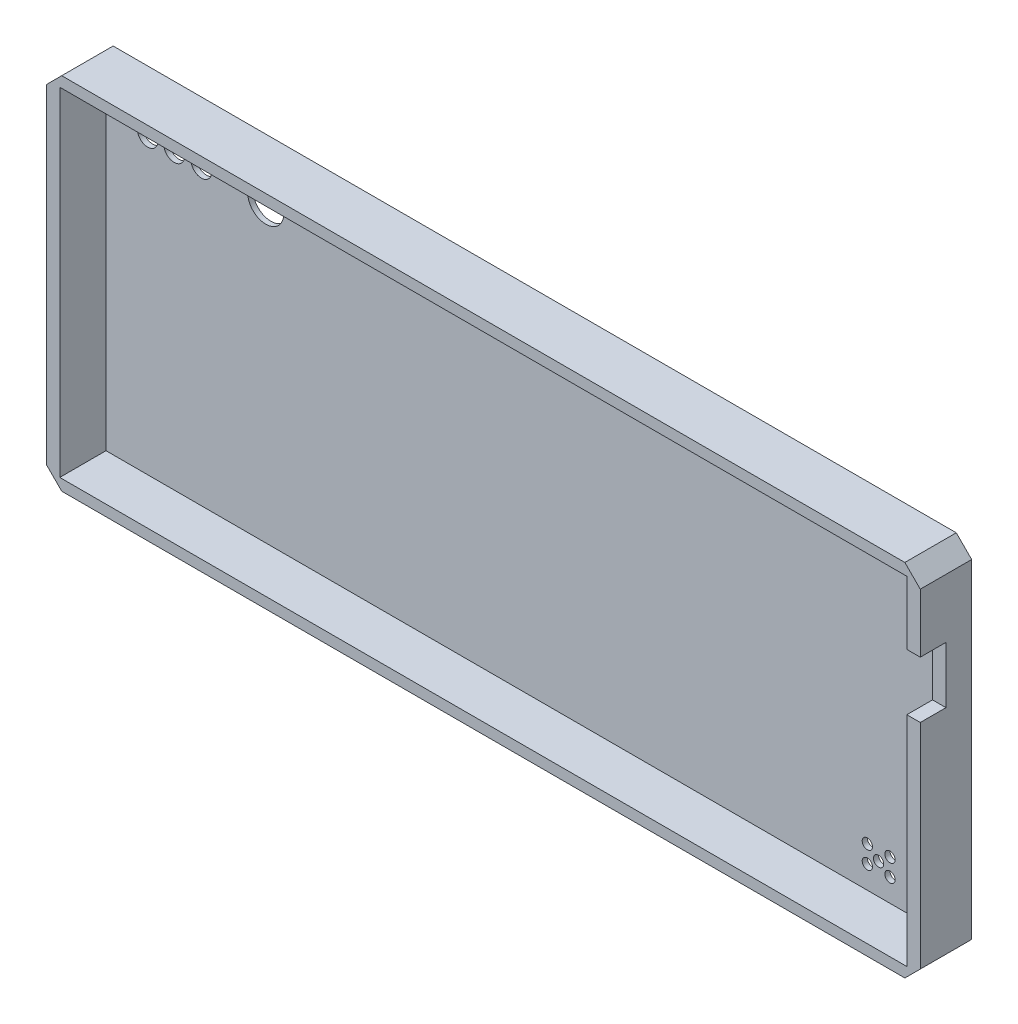
from build123d import *

# Parameters (mm, degrees)
SKETCH1_W           = 170
SKETCH1_H           = 70
BOSS_EXTRUDE1_DEPTH = 10
SKETCH2_W           = 164.770446208
SKETCH2_H           = 65.738312044
CUT_EXTRUDE1_DEPTH  = 9
CHAMFER1_SIZE       = 3
SKETCH3_R           = 1
CUT_EXTRUDE2_DEPTH  = 9
SKETCH4_W           = 5
SKETCH4_H           = 11
CUT_EXTRUDE3_DEPTH  = 9
SKETCH5_R           = 2
SKETCH5_R_2         = 3.5
CUT_EXTRUDE4_DEPTH  = 9
SKETCH7_W           = 0.854807693
SKETCH7_H           = 9.769230769
BOSS_EXTRUDE3_DEPTH = 1


with BuildPart() as part:
    # Sketch1 → Boss-Extrude1 (new body)
    with BuildSketch(Plane.XY):
        with Locations((85, -35)):
            Rectangle(SKETCH1_W, SKETCH1_H)
    extrude(amount=BOSS_EXTRUDE1_DEPTH)

    # Sketch2 → Cut-Extrude1 (cut)
    with BuildSketch(Plane.XY.offset(10)):
        with Locations((85, -35)):
            Rectangle(SKETCH2_W, SKETCH2_H)
    extrude(amount=-CUT_EXTRUDE1_DEPTH, mode=Mode.SUBTRACT)

    # Chamfer1
    chamfer1_edges = [part.edges().sort_by_distance(p)[0] for p in [
        (0, 0, 5),
        (170, 0, 5),
        (170, -70, 5),
        (0, -70, 5),
    ]]
    chamfer(chamfer1_edges, length=CHAMFER1_SIZE)

    # Sketch3 → Cut-Extrude2 (cut)
    with BuildSketch(Plane(origin=(0, 0, 0), x_dir=(-1, 0, 0), z_dir=(0, 0, -1))):
        with Locations((-150.703730792, -63.429213829)):
            Circle(SKETCH3_R)
        with Locations((-155.103392368, -63.429213829)):
            Circle(SKETCH3_R)
        with Locations((-150.703730792, -60.050146517)):
            Circle(SKETCH3_R)
        with Locations((-155.103392368, -60.050146517)):
            Circle(SKETCH3_R)
        with Locations((-152.88343436, -61.881616392)):
            Circle(SKETCH3_R)
    extrude(amount=-CUT_EXTRUDE2_DEPTH, mode=Mode.SUBTRACT)

    # Sketch4 → Cut-Extrude3 (cut)
    with BuildSketch(Plane(origin=(170, 0, 0), x_dir=(0, 0, -1), z_dir=(1, 0, 0))):
        with Locations((-7.5, -19.956286428)):
            Rectangle(SKETCH4_W, SKETCH4_H)
    extrude(amount=-CUT_EXTRUDE3_DEPTH, mode=Mode.SUBTRACT)

    # Sketch5 → Cut-Extrude4 (cut)
    with BuildSketch(Plane(origin=(0, 0, 0), x_dir=(-1, 0, 0), z_dir=(0, 0, -1))):
        with Locations((-10.717530722, -10.676263931)):
            Circle(SKETCH5_R)
        with Locations((-15.865681145, -10.676263931)):
            Circle(SKETCH5_R)
        with Locations((-21.15855192, -10.676263931)):
            Circle(SKETCH5_R)
        with Locations((-33.686164168, -10.676263931)):
            Circle(SKETCH5_R_2)
    extrude(amount=-CUT_EXTRUDE4_DEPTH, mode=Mode.SUBTRACT)

    # Sketch7 → Boss-Extrude3 (add)
    # profile 1 of 8: a face of its own
    with BuildSketch(Plane(origin=(0, 0, 0), x_dir=(-1, 0, 0), z_dir=(0, 0, -1))):
        with BuildLine():
            Line((-68.180263051, -25.837757063), (-67.375064733, -25.355019684))
            add(Edge.make_bspline(
                [(-67.375064733, -25.355019684), (-67.300175816, -25.480380617), (-67.156691541, -25.720567327), (-66.917338199, -26.045119566), (-66.669326491, -26.320969435), (-66.410819805, -26.546512203), (-66.143396046, -26.724082388), (-65.865309443, -26.849818461), (-65.577497115, -26.92823908), (-65.381625501, -26.937764315), (-65.283838772, -26.942519684)],
                knots=[0, 0, 0, 0, 1.272034388, 2.437168799, 3.508375237, 4.49857839, 5.41946034, 6.295179144, 7.148887113, 8, 8, 8, 8], degree=3))
            add(Edge.make_bspline(
                [(-65.283838772, -26.942519684), (-65.200326673, -26.940193753), (-65.03476374, -26.935582591), (-64.791026494, -26.891275551), (-64.554311732, -26.823206829), (-64.329498225, -26.725722723), (-64.119688017, -26.607780129), (-63.935701224, -26.465323746), (-63.776644302, -26.305831144), (-63.646535212, -26.127896919), (-63.546713116, -25.936533822), (-63.469990415, -25.740112126), (-63.427413465, -25.535546236), (-63.420999728, -25.397813477), (-63.417763051, -25.328306943)],
                knots=[0, 0, 0, 0, 1.095163259, 2.171163733, 3.241058638, 4.321873601, 5.38011039, 6.391990106, 7.366004449, 8.327778327, 9.272591725, 10.192022065, 11.087607919, 12, 12, 12, 12], degree=3))
            add(Edge.make_bspline(
                [(-63.417763051, -25.328306943), (-63.421775282, -25.249002202), (-63.429931562, -25.087787252), (-63.498869375, -24.84993534), (-63.607316254, -24.614551988), (-63.707363163, -24.468952116), (-63.759304517, -24.39336103)],
                knots=[0, 0, 0, 0, 0.938893495, 1.908633276, 2.914225137, 4, 4, 4, 4], degree=3))
            add(Edge.make_bspline(
                [(-63.759304517, -24.39336103), (-63.801950974, -24.338805031), (-63.891481876, -24.224271537), (-64.045399107, -24.053787003), (-64.226009747, -23.877932591), (-64.427132993, -23.689993301), (-64.656095184, -23.498710082), (-64.905725063, -23.294961412), (-65.182395993, -23.086495691), (-65.376432481, -22.946688924), (-65.476552113, -22.874550934)],
                knots=[0, 0, 0, 0, 0.722233717, 1.516239348, 2.393582979, 3.351407094, 4.387010283, 5.505090956, 6.712668013, 8, 8, 8, 8], degree=3))
            add(Edge.make_bspline(
                [(-65.476552113, -22.874550934), (-65.576765988, -22.803171706), (-65.768367287, -22.666700058), (-66.036315286, -22.464159685), (-66.275922003, -22.278983154), (-66.48612247, -22.109427236), (-66.66682423, -21.955468933), (-66.819451227, -21.818586684), (-66.940115443, -21.695078565), (-67.007213844, -21.614956056), (-67.037339373, -21.578983025)],
                knots=[0, 0, 0, 0, 1.452282411, 2.77665338, 3.964542531, 5.026858415, 5.96415736, 6.766646006, 7.446254459, 8, 8, 8, 8], degree=3))
            add(Edge.make_bspline(
                [(-67.037339373, -21.578983025), (-67.079446799, -21.522918775), (-67.162256705, -21.412660902), (-67.27156562, -21.240326825), (-67.364472913, -21.063914938), (-67.437304688, -20.882951193), (-67.498635398, -20.699976136), (-67.539886624, -20.512602389), (-67.565716783, -20.32167072), (-67.568361975, -20.193182551), (-67.569686128, -20.128862833)],
                knots=[0, 0, 0, 0, 1.068054152, 2.10047183, 3.106115577, 4.101338837, 5.06977816, 6.043150881, 7.020423561, 8, 8, 8, 8], degree=3))
            add(Edge.make_bspline(
                [(-67.569686128, -20.128862833), (-67.566134095, -20.028088946), (-67.559105951, -19.828695144), (-67.499668543, -19.537418384), (-67.405853025, -19.259325349), (-67.274421937, -18.997169226), (-67.104992998, -18.757776092), (-66.908925025, -18.538392246), (-66.675395195, -18.35396489), (-66.419165556, -18.192823502), (-66.138705001, -18.066696377), (-65.844815471, -17.971552567), (-65.537029867, -17.917643087), (-65.328559908, -17.909906706), (-65.222781079, -17.905981222)],
                knots=[0, 0, 0, 0, 1.005424448, 1.989358655, 2.955360095, 3.929531133, 4.905563448, 5.876582895, 6.856512386, 7.866279853, 8.892233794, 9.918561126, 10.94386622, 12, 12, 12, 12], degree=3))
            add(Edge.make_bspline(
                [(-65.222781079, -17.905981222), (-65.110538207, -17.909852595), (-64.887322956, -17.917551519), (-64.558984734, -17.984491944), (-64.242861642, -18.095255915), (-63.988562471, -18.220955048), (-63.789536884, -18.346498401), (-63.637755376, -18.460852351), (-63.483947171, -18.592501754), (-63.326871607, -18.741797274), (-63.169190241, -18.910108789), (-63.008562132, -19.096283592), (-62.844611657, -19.299183934), (-62.739140352, -19.444030611), (-62.685070743, -19.51828591)],
                knots=[0, 0, 0, 0, 1.286793592, 2.559021753, 3.825965368, 5.121522368, 5.803751409, 6.523245864, 7.299691795, 8.125521123, 9.008227632, 9.944561021, 10.946284179, 12, 12, 12, 12], degree=3))
            Line((-62.685070743, -19.51828591), (-63.457832161, -20.104058145))
            add(Edge.make_bspline(
                [(-63.457832161, -20.104058145), (-63.504493592, -20.043945352), (-63.594352597, -19.928182167), (-63.730776415, -19.766063087), (-63.859360235, -19.617972525), (-63.986043823, -19.489343855), (-64.104136492, -19.373133049), (-64.218755014, -19.273638282), (-64.328249927, -19.189884697), (-64.466272377, -19.100503295), (-64.639675596, -19.011903096), (-64.857347798, -18.936930248), (-65.084821875, -18.891876829), (-65.239751801, -18.885919928), (-65.318183724, -18.882904299)],
                knots=[0, 0, 0, 0, 1.181633172, 2.275549214, 3.290209073, 4.226197932, 5.078386478, 5.862611352, 6.581680152, 7.217281963, 8.414376989, 9.595101626, 10.782541182, 12, 12, 12, 12], degree=3))
            add(Edge.make_bspline(
                [(-65.318183724, -18.882904299), (-65.416581117, -18.886201854), (-65.60633122, -18.892560878), (-65.875726077, -18.962011695), (-66.11818883, -19.071363758), (-66.326521168, -19.224620948), (-66.499976798, -19.406197364), (-66.625449511, -19.615145534), (-66.700969602, -19.845874786), (-66.71018512, -20.00682458), (-66.714878435, -20.088793722)],
                knots=[0, 0, 0, 0, 1.14458467, 2.207223713, 3.21896685, 4.227309161, 5.202851033, 6.127160689, 7.046193047, 8, 8, 8, 8], degree=3))
            add(Edge.make_bspline(
                [(-66.714878435, -20.088793722), (-66.713808569, -20.139824531), (-66.711667088, -20.241969596), (-66.68179996, -20.39287668), (-66.643429643, -20.543402539), (-66.582625767, -20.692870425), (-66.498682476, -20.84389436), (-66.388450533, -20.999074945), (-66.249621448, -21.159779953), (-66.14327615, -21.264302877), (-66.087129036, -21.319487833)],
                knots=[0, 0, 0, 0, 0.858281714, 1.717966888, 2.583508476, 3.4729293, 4.427298488, 5.488583878, 6.674047936, 8, 8, 8, 8], degree=3))
            add(Edge.make_bspline(
                [(-66.087129036, -21.319487833), (-66.066279158, -21.33809431), (-66.016744621, -21.382299041), (-65.926186566, -21.454668034), (-65.80659938, -21.543938435), (-65.661105818, -21.654393918), (-65.487023212, -21.782522754), (-65.28433242, -21.926686656), (-65.05529282, -22.091565655), (-64.892763892, -22.206838676), (-64.806825551, -22.267790116)],
                knots=[0, 0, 0, 0, 0.420754252, 0.999615792, 1.744751191, 2.668019286, 3.750313428, 4.999500688, 6.413464383, 8, 8, 8, 8], degree=3))
            add(Edge.make_bspline(
                [(-64.806825551, -22.267790116), (-64.703449601, -22.343014102), (-64.503276402, -22.488674924), (-64.218458274, -22.707520453), (-63.960211553, -22.921554738), (-63.727629549, -23.12941094), (-63.518414534, -23.329512393), (-63.334887594, -23.524266477), (-63.175178707, -23.712277928), (-63.003240976, -23.953321866), (-62.827551482, -24.249361817), (-62.67667138, -24.612069023), (-62.581534734, -24.976186153), (-62.569093681, -25.220915615), (-62.562955358, -25.341663313)],
                knots=[0, 0, 0, 0, 1.163667725, 2.253281268, 3.268753668, 4.215851969, 5.092017293, 5.902905408, 6.650798638, 7.335211899, 8.59617414, 9.77448103, 10.901945474, 12, 12, 12, 12], degree=3))
            add(Edge.make_bspline(
                [(-62.562955358, -25.341663313), (-62.564743713, -25.427057293), (-62.568285693, -25.596186958), (-62.609000751, -25.844531131), (-62.668653554, -26.085733712), (-62.758562027, -26.31681324), (-62.868298622, -26.541997201), (-63.007543911, -26.755378702), (-63.168945538, -26.961680401), (-63.35409457, -27.155401188), (-63.556693776, -27.333236193), (-63.77082583, -27.491430281), (-63.996841216, -27.623333361), (-64.233513835, -27.730968153), (-64.480898051, -27.815151511), (-64.738910663, -27.876146534), (-65.007976976, -27.913581719), (-65.190858286, -27.917467269), (-65.283838772, -27.919442761)],
                knots=[0, 0, 0, 0, 0.983748083, 1.948392443, 2.894712957, 3.844097841, 4.80183111, 5.778335162, 6.776009319, 7.81870978, 8.863265674, 9.881300176, 10.883814829, 11.87499822, 12.874611388, 13.892143829, 14.928324115, 16, 16, 16, 16], degree=3))
            add(Edge.make_bspline(
                [(-65.283838772, -27.919442761), (-65.355780669, -27.918051616), (-65.498758431, -27.915286848), (-65.710239235, -27.890844935), (-65.917447688, -27.85626346), (-66.117783699, -27.80136117), (-66.313828369, -27.734748825), (-66.504729057, -27.652729505), (-66.690578282, -27.554439122), (-66.872417562, -27.442057662), (-67.049784422, -27.311271943), (-67.22101526, -27.15894407), (-67.391728258, -26.989275231), (-67.556884672, -26.797657913), (-67.719825158, -26.587187844), (-67.877337115, -26.355895852), (-68.032680932, -26.105041768), (-68.13015017, -25.928516071), (-68.180263051, -25.837757063)],
                knots=[0, 0, 0, 0, 0.915332311, 1.819136955, 2.706846663, 3.586547465, 4.459518054, 5.340707479, 6.227863349, 7.133153174, 8.059268498, 9.028702269, 10.047606654, 11.120612155, 12.245963614, 13.433783089, 14.680604001, 16, 16, 16, 16], degree=3))
        make_face()
    # profile 2 of 8: a face of its own
    with BuildSketch(Plane(origin=(0, 0, 0), x_dir=(-1, 0, 0), z_dir=(0, 0, -1))):
        Polygon((-61.097570743, -27.675211991), (-59.840163892, -18.150211991), (-59.718048507, -18.150211991), (-55.785551512, -25.965596607), (-51.862594781, -18.150211991), (-51.738571344, -18.150211991), (-50.473532281, -27.675211991), (-51.332156079, -27.675211991), (-52.244205358, -20.82148603), (-55.682516656, -27.675211991), (-55.875229998, -27.675211991), (-59.326897666, -20.806221607), (-60.237038892, -27.675211991), align=None)
    # profile 3 of 8: a face of its own
    with BuildSketch(Plane(origin=(0, 0, 0), x_dir=(-1, 0, 0), z_dir=(0, 0, -1))):
        with BuildLine():
            Line((-44.856224589, -18.150211991), (-42.988240815, -18.150211991))
            add(Edge.make_bspline(
                [(-42.988240815, -18.150211991), (-42.859759706, -18.150353223), (-42.613584196, -18.15062383), (-42.260573937, -18.158828245), (-41.939963167, -18.1697866), (-41.652443202, -18.184977324), (-41.397129392, -18.202929473), (-41.175177027, -18.228108237), (-40.98484152, -18.254398042), (-40.870796111, -18.281126298), (-40.818784685, -18.293315958)],
                knots=[0, 0, 0, 0, 1.415646017, 2.712440637, 3.8905458, 4.950247383, 5.884950622, 6.709939814, 7.411656543, 8, 8, 8, 8], degree=3))
            add(Edge.make_bspline(
                [(-40.818784685, -18.293315958), (-40.752943711, -18.311337121), (-40.622813223, -18.346954802), (-40.435303956, -18.418293578), (-40.256903848, -18.50288147), (-40.087000821, -18.599285192), (-39.927682723, -18.711640906), (-39.776572569, -18.835394109), (-39.635003908, -18.97340202), (-39.503772835, -19.124116748), (-39.383254921, -19.285008176), (-39.279487713, -19.458478102), (-39.192600046, -19.641606578), (-39.118078428, -19.834266225), (-39.064443277, -20.038074891), (-39.0240385, -20.251616444), (-38.998392771, -20.474867994), (-38.995936513, -20.627430919), (-38.994686128, -20.705094804)],
                knots=[0, 0, 0, 0, 0.999701418, 1.975846123, 2.934577507, 3.890451536, 4.834027766, 5.787354733, 6.749476667, 7.726910423, 8.712836071, 9.690891519, 10.682875813, 11.679750201, 12.712814741, 13.765529915, 14.8625177, 16, 16, 16, 16], degree=3))
            add(Edge.make_bspline(
                [(-38.994686128, -20.705094804), (-38.995833005, -20.783411468), (-38.998076948, -20.93664331), (-39.025008981, -21.16081497), (-39.061286146, -21.375041446), (-39.11706741, -21.578847736), (-39.190125991, -21.771023511), (-39.275829364, -21.954505578), (-39.379198829, -22.1261724), (-39.497975115, -22.286647198), (-39.630104811, -22.436080602), (-39.775028879, -22.573389722), (-39.932162239, -22.697770814), (-40.101005513, -22.809502721), (-40.283204745, -22.905994453), (-40.475996606, -22.99241969), (-40.681056837, -23.065003076), (-40.822958965, -23.103184886), (-40.895106801, -23.122597809)],
                knots=[0, 0, 0, 0, 1.121902311, 2.195077645, 3.232258892, 4.234102512, 5.217864754, 6.176164875, 7.132989551, 8.084763148, 9.034132444, 9.988522005, 10.94243251, 11.903244335, 12.886203696, 13.894208494, 14.929344452, 16, 16, 16, 16], degree=3))
            add(Edge.make_bspline(
                [(-40.895106801, -23.122597809), (-40.954780474, -23.135287779), (-41.085558798, -23.163098585), (-41.300940064, -23.194145886), (-41.55170715, -23.220646071), (-41.837517783, -23.240515595), (-42.158115417, -23.257525526), (-42.513673482, -23.271045839), (-42.904889934, -23.278474941), (-43.177770963, -23.278858099), (-43.320242017, -23.279058145)],
                knots=[0, 0, 0, 0, 0.601384939, 1.31797006, 2.144135048, 3.087295005, 4.142315834, 5.309527816, 6.595305764, 8, 8, 8, 8], degree=3))
            Line((-43.320242017, -23.279058145), (-44.001416897, -23.279058145))
            Line((-44.001416897, -23.279058145), (-44.001416897, -27.675211991))
            Line((-44.001416897, -27.675211991), (-44.856224589, -27.675211991))
            Line((-44.856224589, -27.675211991), (-44.856224589, -18.150211991))
        make_face()
        with BuildLine():
            Line((-44.001416897, -19.127135068), (-44.001416897, -22.302135068))
            Line((-44.001416897, -22.302135068), (-42.333778676, -22.32312365))
            add(Edge.make_bspline(
                [(-42.333778676, -22.32312365), (-42.252353735, -22.323165733), (-42.095164565, -22.323246973), (-41.868098843, -22.312401472), (-41.657434997, -22.299881451), (-41.463820117, -22.281550117), (-41.287166924, -22.255638695), (-41.127180863, -22.229481036), (-40.985102472, -22.191638585), (-40.818825358, -22.14068509), (-40.633541391, -22.053782757), (-40.431971848, -21.927644842), (-40.261146181, -21.766860915), (-40.113322817, -21.586082317), (-39.996013249, -21.384971115), (-39.91013587, -21.169790651), (-39.859677434, -20.942747718), (-39.852911436, -20.787386426), (-39.84949382, -20.70891091)],
                knots=[0, 0, 0, 0, 1.160613943, 2.240541288, 3.23993089, 4.169200891, 5.011653406, 5.7853311, 6.478053781, 7.106038997, 8.262395093, 9.384106736, 10.481365981, 11.59014053, 12.70357646, 13.786202915, 14.881775077, 16, 16, 16, 16], degree=3))
            add(Edge.make_bspline(
                [(-39.84949382, -20.70891091), (-39.852930022, -20.632333955), (-39.859760767, -20.480108447), (-39.910531366, -20.257009106), (-39.995846284, -20.044096225), (-40.114110302, -19.845505185), (-40.25764152, -19.665377083), (-40.424463304, -19.508902759), (-40.614182965, -19.383113696), (-40.790662794, -19.301924551), (-40.947420307, -19.25235298), (-41.083578712, -19.217668807), (-41.237314048, -19.189976622), (-41.408676362, -19.167553403), (-41.59633746, -19.148357912), (-41.801909589, -19.135333217), (-42.024614003, -19.127709254), (-42.179219914, -19.127331097), (-42.259364613, -19.127135068)],
                knots=[0, 0, 0, 0, 1.120700087, 2.227813068, 3.331159281, 4.466773991, 5.599788987, 6.693661531, 7.80175334, 8.91857717, 9.525282508, 10.207424825, 10.974604443, 11.810962634, 12.737642355, 13.736264703, 14.826523623, 16, 16, 16, 16], degree=3))
            Line((-42.259364613, -19.127135068), (-44.001416897, -19.127135068))
        make_face(mode=Mode.SUBTRACT)
    # profile 4 of 8: a face of its own
    with BuildSketch(Plane(origin=(0, 0, 0), x_dir=(-1, 0, 0), z_dir=(0, 0, -1))):
        with Locations((-36.979782282, -22.790596607)):
            Rectangle(SKETCH7_W, SKETCH7_H)
    # profile 5 of 8: a face of its own
    with BuildSketch(Plane(origin=(0, 0, 0), x_dir=(-1, 0, 0), z_dir=(0, 0, -1))):
        with BuildLine():
            Line((-27.515839974, -20.714635068), (-27.515839974, -27.675211991))
            Line((-27.515839974, -27.675211991), (-28.370647666, -27.675211991))
            Line((-28.370647666, -27.675211991), (-28.370647666, -26.471230621))
            add(Edge.make_bspline(
                [(-28.370647666, -26.471230621), (-28.467037375, -26.580195516), (-28.655143104, -26.792841879), (-28.96930786, -27.07065122), (-29.302324116, -27.300280795), (-29.652575568, -27.485745922), (-30.019745931, -27.625061447), (-30.403021282, -27.72408378), (-30.802557969, -27.787748432), (-31.075387592, -27.794105748), (-31.213646464, -27.797327376)],
                knots=[0, 0, 0, 0, 1.074387032, 2.096679803, 3.090159297, 4.057316773, 5.018401886, 5.985159533, 6.978961417, 8, 8, 8, 8], degree=3))
            add(Edge.make_bspline(
                [(-31.213646464, -27.797327376), (-31.336567824, -27.793989891), (-31.578974189, -27.787408224), (-31.935560463, -27.736347955), (-32.278711513, -27.65434962), (-32.6087516, -27.540319343), (-32.923545082, -27.389060106), (-33.225787202, -27.207972853), (-33.513912171, -26.992324594), (-33.783528288, -26.745795745), (-34.03180966, -26.478020816), (-34.249690695, -26.192419006), (-34.431354434, -25.890225308), (-34.583264796, -25.575265796), (-34.700276277, -25.245115908), (-34.781847381, -24.900917329), (-34.832848168, -24.543077031), (-34.839427115, -24.299401614), (-34.842763051, -24.175843001)],
                knots=[0, 0, 0, 0, 1.033919861, 2.038935746, 3.024066025, 3.998881131, 4.97069526, 5.957263378, 6.95902576, 7.993208707, 9.027059324, 10.027763471, 11.009749337, 11.988697705, 12.965288445, 13.950418724, 14.960734635, 16, 16, 16, 16], degree=3))
            add(Edge.make_bspline(
                [(-34.842763051, -24.175843001), (-34.839353179, -24.054838208), (-34.832612045, -23.815618259), (-34.782392926, -23.463795517), (-34.697944252, -23.124927964), (-34.579431895, -22.800106569), (-34.427462003, -22.488938289), (-34.242600567, -22.19120305), (-34.024834234, -21.906080618), (-33.773775898, -21.640275351), (-33.501810559, -21.394746394), (-33.210866084, -21.181361777), (-32.908179869, -20.99707521), (-32.589056962, -20.851061106), (-32.258220769, -20.732926329), (-31.912726035, -20.651193752), (-31.554010239, -20.603031756), (-31.310468257, -20.596057376), (-31.186933724, -20.592519684)],
                knots=[0, 0, 0, 0, 1.020392517, 2.01726096, 2.990465484, 3.961182959, 4.928053699, 5.906110375, 6.912531644, 7.948652711, 8.985773172, 9.998621852, 10.987621588, 11.969261332, 12.953316658, 13.946091881, 14.958173133, 16, 16, 16, 16], degree=3))
            add(Edge.make_bspline(
                [(-31.186933724, -20.592519684), (-31.044875536, -20.596432422), (-30.766306134, -20.604105117), (-30.358832052, -20.667957253), (-29.973356723, -20.77583051), (-29.606904522, -20.92256313), (-29.260791369, -21.117550028), (-28.938293961, -21.363512636), (-28.636037182, -21.658899724), (-28.460830817, -21.885786433), (-28.370647666, -22.002570765)],
                knots=[0, 0, 0, 0, 1.038897134, 2.037228247, 3.008116434, 3.962042015, 4.918381754, 5.904844433, 6.921570401, 8, 8, 8, 8], degree=3))
            Line((-28.370647666, -22.002570765), (-28.370647666, -20.714635068))
            Line((-28.370647666, -20.714635068), (-27.515839974, -20.714635068))
        make_face()
        with BuildLine():
            add(Edge.make_bspline(
                [(-31.175485406, -21.447327376), (-31.300437997, -21.451773204), (-31.547074537, -21.460548562), (-31.909144286, -21.529056431), (-32.255618648, -21.643042363), (-32.58476475, -21.798930966), (-32.891383254, -21.994952027), (-33.165413887, -22.232046649), (-33.409097953, -22.503745952), (-33.614044015, -22.808823838), (-33.781113867, -23.135879929), (-33.898589861, -23.477757864), (-33.976066884, -23.82829141), (-33.983982215, -24.066042719), (-33.987955358, -24.185383265)],
                knots=[0, 0, 0, 0, 1.031046209, 2.035121221, 3.029706178, 4.034933723, 5.034054252, 6.02443088, 7.017295772, 8.038157696, 9.050218397, 10.03989886, 11.016116709, 12, 12, 12, 12], degree=3))
            add(Edge.make_bspline(
                [(-33.987955358, -24.185383265), (-33.982880184, -24.304010628), (-33.972749729, -24.540800375), (-33.899949625, -24.891811802), (-33.777812256, -25.233770302), (-33.611146356, -25.563773435), (-33.402449185, -25.870163022), (-33.160545066, -26.147041499), (-32.883094658, -26.385138164), (-32.575770513, -26.584448989), (-32.247544537, -26.745455564), (-31.902375052, -26.857484911), (-31.546750637, -26.929814443), (-31.304945357, -26.938263055), (-31.183117618, -26.942519684)],
                knots=[0, 0, 0, 0, 0.979072187, 1.954306742, 2.945804271, 3.96968567, 4.997920485, 5.998718438, 6.996577872, 8.005894225, 9.015743152, 10.005417472, 10.995077863, 12, 12, 12, 12], degree=3))
            add(Edge.make_bspline(
                [(-31.183117618, -26.942519684), (-31.059438207, -26.93800221), (-30.813452125, -26.929017404), (-30.450308213, -26.860216246), (-30.097896921, -26.746545445), (-29.761018821, -26.588977107), (-29.447194207, -26.393694589), (-29.165532126, -26.165075291), (-28.927363669, -25.899183054), (-28.725453782, -25.606965707), (-28.56713354, -25.286620917), (-28.451810122, -24.945532869), (-28.383627707, -24.58368969), (-28.375034171, -24.336410003), (-28.370647666, -24.210187953)],
                knots=[0, 0, 0, 0, 1.01762866, 2.023962475, 3.030623092, 4.058876274, 5.077231937, 6.066672613, 7.034107872, 8.005628644, 8.981990164, 9.965428785, 10.961468474, 12, 12, 12, 12], degree=3))
            add(Edge.make_bspline(
                [(-28.370647666, -24.210187953), (-28.373259302, -24.114018571), (-28.378399829, -23.924726795), (-28.417671593, -23.64679405), (-28.480141786, -23.380818696), (-28.568169577, -23.126521092), (-28.683806572, -22.885307229), (-28.823273707, -22.655445139), (-28.989023538, -22.438130328), (-29.178387875, -22.236355256), (-29.385666033, -22.052314669), (-29.604998319, -21.8880377), (-29.838983337, -21.753085397), (-30.083686131, -21.641394508), (-30.339531262, -21.552514965), (-30.608600592, -21.493221312), (-30.888034121, -21.452507867), (-31.078659457, -21.449072388), (-31.175485406, -21.447327376)],
                knots=[0, 0, 0, 0, 1.050140795, 2.067009409, 3.05949893, 4.030605086, 5.00011959, 5.97591094, 6.962425594, 7.979863591, 8.993523472, 9.986985069, 10.967611495, 11.937549037, 12.921786183, 13.919465291, 14.943216303, 16, 16, 16, 16], degree=3))
        make_face(mode=Mode.SUBTRACT)
    # profile 6 of 8: a face of its own
    with BuildSketch(Plane(origin=(0, 0, 0), x_dir=(-1, 0, 0), z_dir=(0, 0, -1))):
        Polygon((-26.294686128, -20.714635068), (-25.373096584, -20.714635068), (-23.016651272, -26.045734828), (-20.623952954, -20.714635068), (-19.700455358, -20.714635068), (-23.97449382, -30.239635068), (-24.897991416, -30.239635068), (-23.480308123, -27.081807544), align=None)
    # profile 7 of 8: a face of its own
    with BuildSketch(Plane(origin=(0, 0, 0), x_dir=(-1, 0, 0), z_dir=(0, 0, -1))):
        with BuildLine():
            Line((-12.88870656, -25.477135068), (-12.129301512, -25.875918121))
            add(Edge.make_bspline(
                [(-12.129301512, -25.875918121), (-12.189816818, -25.98326033), (-12.307555638, -26.19210576), (-12.510031959, -26.479031037), (-12.722281814, -26.737152321), (-12.953886184, -26.959573737), (-13.19791581, -27.153479292), (-13.455723963, -27.323127229), (-13.728652817, -27.467685488), (-14.016715283, -27.589476296), (-14.32233049, -27.683119277), (-14.646239045, -27.749261478), (-14.989061472, -27.79014623), (-15.224046433, -27.794895506), (-15.344370623, -27.797327376)],
                knots=[0, 0, 0, 0, 1.120438281, 2.179929193, 3.190490725, 4.156257408, 5.095198341, 6.022838206, 6.959905092, 7.901321166, 8.864066838, 9.862729781, 10.905609505, 12, 12, 12, 12], degree=3))
            add(Edge.make_bspline(
                [(-15.344370623, -27.797327376), (-15.478107004, -27.79420542), (-15.738987942, -27.788115389), (-16.118735396, -27.735612325), (-16.476275099, -27.649962549), (-16.811586949, -27.530313468), (-17.123849793, -27.374029108), (-17.413684263, -27.183639375), (-17.682614544, -26.96012231), (-17.922166142, -26.701541846), (-18.137822708, -26.424821663), (-18.328120832, -26.136470291), (-18.487208556, -25.83721323), (-18.616619588, -25.52895559), (-18.721135684, -25.21364028), (-18.793979357, -24.888398357), (-18.835970314, -24.554110089), (-18.842404983, -24.327966625), (-18.845647666, -24.214004059)],
                knots=[0, 0, 0, 0, 1.145258523, 2.234067595, 3.276747158, 4.290159414, 5.277019952, 6.260822364, 7.254936242, 8.264827045, 9.274100331, 10.257902744, 11.220704747, 12.172965371, 13.118907548, 14.062713208, 15.023725156, 16, 16, 16, 16], degree=3))
            add(Edge.make_bspline(
                [(-18.845647666, -24.214004059), (-18.842765289, -24.107065984), (-18.837052797, -23.895128843), (-18.801046154, -23.581441897), (-18.737233299, -23.276564466), (-18.649667732, -22.980243218), (-18.536588984, -22.692974296), (-18.39825273, -22.414582866), (-18.234443473, -22.145365164), (-18.107971411, -21.975539493), (-18.044265454, -21.889995645)],
                knots=[0, 0, 0, 0, 1.024358464, 2.0301432, 3.019427413, 4.004406732, 4.986367066, 5.972626655, 6.978780325, 8, 8, 8, 8], degree=3))
            add(Edge.make_bspline(
                [(-18.044265454, -21.889995645), (-17.957975261, -21.78693822), (-17.788128327, -21.584087968), (-17.500864246, -21.31755581), (-17.189804426, -21.094279536), (-16.858847072, -20.909202973), (-16.504145668, -20.768576833), (-16.13046824, -20.663781199), (-15.733559895, -20.605058183), (-15.462219258, -20.596763721), (-15.323382041, -20.592519684)],
                knots=[0, 0, 0, 0, 1.030682036, 2.02871468, 2.997146059, 3.962720338, 4.930598197, 5.918074684, 6.934738563, 8, 8, 8, 8], degree=3))
            add(Edge.make_bspline(
                [(-15.323382041, -20.592519684), (-15.180649629, -20.596204631), (-14.900641174, -20.603433658), (-14.492339474, -20.670452465), (-14.106003524, -20.776731203), (-13.741787923, -20.926828304), (-13.399655744, -21.120483941), (-13.081830852, -21.360355667), (-12.782877807, -21.639079176), (-12.608955175, -21.853427624), (-12.520452354, -21.962501655)],
                knots=[0, 0, 0, 0, 1.056321875, 2.072262726, 3.055038591, 4.01806755, 4.982017516, 5.957941055, 6.960871419, 8, 8, 8, 8], degree=3))
            add(Edge.make_bspline(
                [(-12.520452354, -21.962501655), (-12.460235471, -22.044698544), (-12.340202529, -22.208545196), (-12.189851492, -22.475710987), (-12.059338867, -22.755230534), (-11.955018452, -23.051622128), (-11.870546667, -23.361373985), (-11.809432038, -23.686700482), (-11.773591862, -24.027504741), (-11.766546907, -24.259714867), (-11.762955358, -24.378096607)],
                knots=[0, 0, 0, 0, 0.94817472, 1.890038105, 2.849395472, 3.817997239, 4.812318967, 5.836947057, 6.897266129, 8, 8, 8, 8], degree=3))
            Line((-11.762955358, -24.378096607), (-17.990839974, -24.378096607))
            add(Edge.make_bspline(
                [(-17.990839974, -24.378096607), (-17.986650045, -24.469810013), (-17.978410719, -24.650160727), (-17.939997365, -24.914059787), (-17.879448916, -25.16544724), (-17.794352396, -25.402437518), (-17.691300481, -25.628125937), (-17.565065066, -25.840838337), (-17.414462423, -26.039605847), (-17.246480341, -26.226206414), (-17.059498889, -26.392378914), (-16.862786555, -26.54110982), (-16.65352621, -26.665766479), (-16.433367855, -26.766948893), (-16.202667496, -26.846159654), (-15.961352451, -26.900228508), (-15.709897577, -26.936442849), (-15.538486401, -26.940469652), (-15.451221584, -26.942519684)],
                knots=[0, 0, 0, 0, 1.094153842, 2.151609401, 3.174256925, 4.172055639, 5.149267565, 6.128595816, 7.11444997, 8.118368179, 9.117203808, 10.09244225, 11.054858984, 12.015122123, 12.976791628, 13.957293641, 14.960065497, 16, 16, 16, 16], degree=3))
            add(Edge.make_bspline(
                [(-15.451221584, -26.942519684), (-15.365901675, -26.940864901), (-15.196610609, -26.937581494), (-14.944495133, -26.905653937), (-14.69646542, -26.854027687), (-14.453548029, -26.783569928), (-14.220673084, -26.69763578), (-14.00501198, -26.593941575), (-13.806673679, -26.47923405), (-13.62129822, -26.348034863), (-13.441490731, -26.187448297), (-13.263121536, -25.987053942), (-13.071868644, -25.750051456), (-12.952154109, -25.571673607), (-12.88870656, -25.477135068)],
                knots=[0, 0, 0, 0, 0.99110716, 1.966546729, 2.947904876, 3.932708344, 4.903319531, 5.828989031, 6.710028674, 7.56322171, 8.463672341, 9.504779593, 10.677557249, 12, 12, 12, 12], degree=3))
        make_face()
        with BuildLine():
            add(Edge.make_bspline(
                [(-12.617763051, -23.523288914), (-12.649050293, -23.409906379), (-12.709268164, -23.191681498), (-12.835097127, -22.889491646), (-12.976806105, -22.620919572), (-13.144505246, -22.388020714), (-13.334511921, -22.181182582), (-13.553982025, -22.000429147), (-13.800096849, -21.838728798), (-14.071584225, -21.702242353), (-14.359080797, -21.586064952), (-14.660087648, -21.508163744), (-14.967222057, -21.454797775), (-15.174960364, -21.449828151), (-15.279496825, -21.447327376)],
                knots=[0, 0, 0, 0, 1.154881502, 2.222775134, 3.210006277, 4.132804581, 5.035138423, 5.962687519, 6.919655026, 7.923214229, 8.944639381, 9.960483929, 10.97369054, 12, 12, 12, 12], degree=3))
            add(Edge.make_bspline(
                [(-15.279496825, -21.447327376), (-15.364812082, -21.448991996), (-15.53346241, -21.452282601), (-15.781931746, -21.483497739), (-16.020545783, -21.535095602), (-16.251065173, -21.605757377), (-16.470469108, -21.699942217), (-16.683270584, -21.810386569), (-16.884058663, -21.945210451), (-17.009628903, -22.047968477), (-17.073066536, -22.099881462)],
                knots=[0, 0, 0, 0, 1.04873581, 2.073130211, 3.073294108, 4.04793562, 5.032784715, 6.005352987, 6.992311501, 8, 8, 8, 8], degree=3))
            add(Edge.make_bspline(
                [(-17.073066536, -22.099881462), (-17.118496111, -22.140959564), (-17.210434497, -22.224091631), (-17.333281202, -22.367318257), (-17.450902632, -22.52176358), (-17.557946358, -22.693336383), (-17.656128933, -22.880082932), (-17.748004299, -23.080428068), (-17.830698749, -23.295892087), (-17.877224591, -23.446039939), (-17.901161488, -23.523288914)],
                knots=[0, 0, 0, 0, 0.879870761, 1.780643979, 2.707998968, 3.669668524, 4.684282772, 5.740141944, 6.837334558, 8, 8, 8, 8], degree=3))
            Line((-17.901161488, -23.523288914), (-12.617763051, -23.523288914))
        make_face(mode=Mode.SUBTRACT)
    # profile 8 of 8: a face of its own
    with BuildSketch(Plane(origin=(0, 0, 0), x_dir=(-1, 0, 0), z_dir=(0, 0, -1))):
        with BuildLine():
            Line((-10.297570743, -20.714635068), (-9.442763051, -20.714635068))
            Line((-9.442763051, -20.714635068), (-9.442763051, -21.739259467))
            add(Edge.make_bspline(
                [(-9.442763051, -21.739259467), (-9.3796565, -21.643857534), (-9.258965712, -21.461402079), (-9.05836124, -21.22009491), (-8.852884317, -21.020301105), (-8.641551272, -20.861087957), (-8.422808014, -20.741853684), (-8.20145531, -20.654514781), (-7.974010638, -20.602869373), (-7.821169973, -20.595974202), (-7.744595983, -20.592519684)],
                knots=[0, 0, 0, 0, 1.2804753, 2.448899062, 3.506932113, 4.484331642, 5.4025378, 6.288909075, 7.142734305, 8, 8, 8, 8], degree=3))
            add(Edge.make_bspline(
                [(-7.744595983, -20.592519684), (-7.685197195, -20.595759617), (-7.562980327, -20.60242599), (-7.377970565, -20.649264019), (-7.187352314, -20.724043495), (-7.064500531, -20.794365815), (-7.000455358, -20.831026294)],
                knots=[0, 0, 0, 0, 0.901110191, 1.854092781, 2.881294221, 4, 4, 4, 4], degree=3))
            Line((-7.000455358, -20.831026294), (-7.469836368, -21.571350813))
            add(Edge.make_bspline(
                [(-7.469836368, -21.571350813), (-7.51095449, -21.553007661), (-7.589004556, -21.518188845), (-7.703180912, -21.476980946), (-7.808449407, -21.452716918), (-7.875515091, -21.449041037), (-7.906780479, -21.447327376)],
                knots=[0, 0, 0, 0, 1.180555205, 2.24091978, 3.179933427, 4, 4, 4, 4], degree=3))
            add(Edge.make_bspline(
                [(-7.906780479, -21.447327376), (-7.975376082, -21.451899478), (-8.115291229, -21.46122524), (-8.320716902, -21.534537281), (-8.52005394, -21.652988113), (-8.678363964, -21.784354496), (-8.800943238, -21.911031002), (-8.888410566, -22.021652726), (-8.968645756, -22.145691716), (-9.045308999, -22.281027498), (-9.115157985, -22.429970865), (-9.180348906, -22.591033753), (-9.239291954, -22.764402711), (-9.272902262, -22.885186569), (-9.29011882, -22.947056943)],
                knots=[0, 0, 0, 0, 1.125678352, 2.296057538, 3.5422874, 4.923748041, 5.663163013, 6.437101912, 7.23742474, 8.08941207, 8.991984279, 9.93940061, 10.944477711, 12, 12, 12, 12], degree=3))
            add(Edge.make_bspline(
                [(-9.29011882, -22.947056943), (-9.30299769, -23.002239823), (-9.33152341, -23.124465708), (-9.359258952, -23.329521336), (-9.386662426, -23.571792864), (-9.405975366, -23.851954663), (-9.423877038, -24.1693071), (-9.433973762, -24.524333638), (-9.442418737, -24.917398686), (-9.442644798, -25.192193176), (-9.442763051, -25.335939155)],
                knots=[0, 0, 0, 0, 0.566838948, 1.255505196, 2.06880316, 3.007127437, 4.065329342, 5.249902469, 6.561414163, 8, 8, 8, 8], degree=3))
            Line((-9.442763051, -25.335939155), (-9.442763051, -27.675211991))
            Line((-9.442763051, -27.675211991), (-10.297570743, -27.675211991))
            Line((-10.297570743, -27.675211991), (-10.297570743, -20.714635068))
        make_face()
    extrude(amount=BOSS_EXTRUDE3_DEPTH)


solid = part.part
